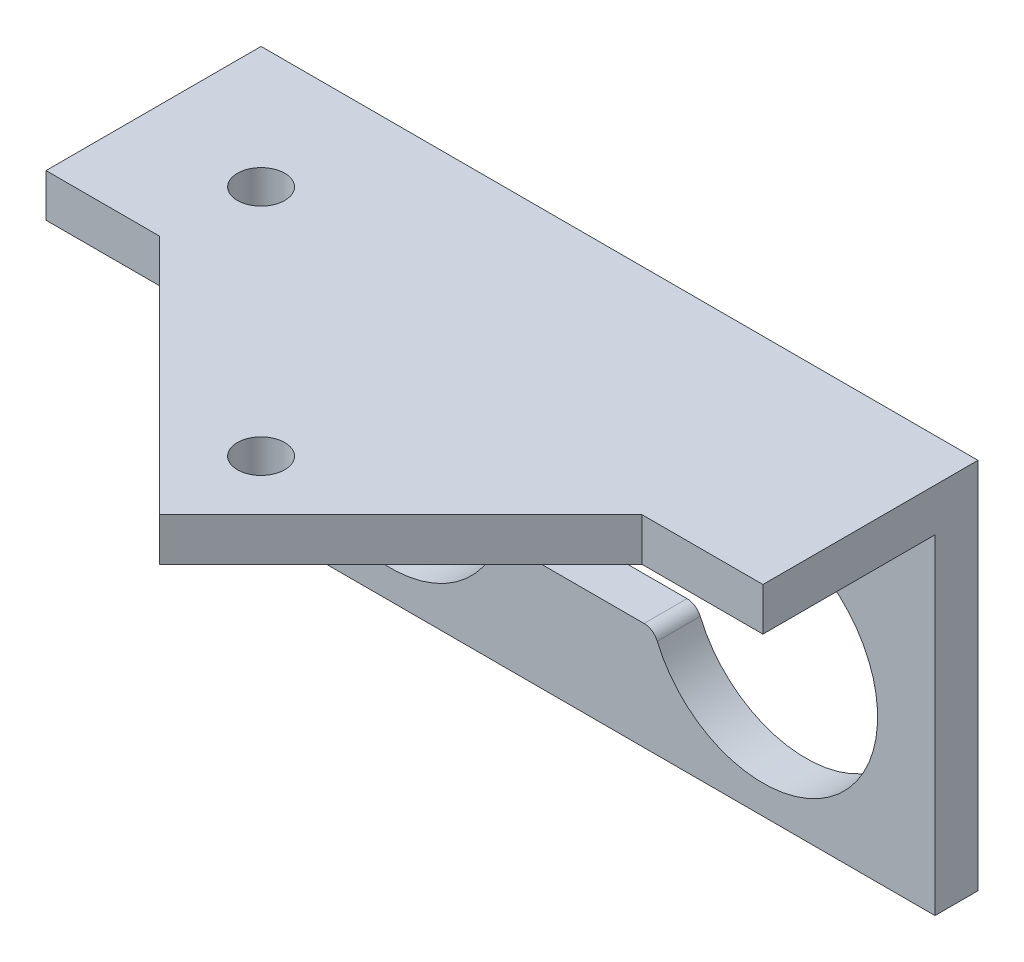
from build123d import *

# Parameters (mm, degrees)
SKETCH_1_W          = 50
SKETCH_1_H          = 20
EXTRUDE_1_DEPTH     = 3
SKETCH_2_W          = 50
SKETCH_2_H          = 15
EXTRUDE_2_DEPTH     = 6
SKETCH_5_W          = 50
SKETCH_5_H          = 12
CUT_EXTRUDE_2_DEPTH = 3
SKETCH_7_R          = 1.65
EXTRUDE_3_DEPTH     = 3
SKETCH_8_R          = 1.65
CUT_EXTRUDE_3_DEPTH = 3


with BuildPart() as part:
    # 草图1 → 凸台-拉伸1 (new body)
    with BuildSketch(Plane.XY):
        Rectangle(SKETCH_1_W, SKETCH_1_H)
        with BuildLine():
            Line((-4.708438024, 2.5), (4.708438024, 2.5))
            ThreePointArc((4.708438024, 2.5), (5.261208823, 2.666666667), (5.629722688, 3.111111111))
            ThreePointArc((5.629722688, 3.111111111), (21, 0), (5.629722688, -3.111111111))
            ThreePointArc((5.629722688, -3.111111111), (5.261208823, -2.666666667), (4.708438024, -2.5))
            Line((4.708438024, -2.5), (-4.708438024, -2.5))
            ThreePointArc((-4.708438024, -2.5), (-5.261208823, -2.666666667), (-5.629722688, -3.111111111))
            ThreePointArc((-5.629722688, -3.111111111), (-21, 0), (-5.629722688, 3.111111111))
            ThreePointArc((-5.629722688, 3.111111111), (-5.261208823, 2.666666667), (-4.708438024, 2.5))
        make_face(mode=Mode.SUBTRACT)
        with BuildLine():
            Line((3.25, 5.5), (-3.25, 5.5))
            ThreePointArc((-3.25, 5.5), (-5, 7.25), (-3.25, 9))
            Line((-3.25, 9), (3.25, 9))
            ThreePointArc((3.25, 9), (5, 7.25), (3.25, 5.5))
        make_face(mode=Mode.SUBTRACT)
    extrude(amount=EXTRUDE_1_DEPTH)

    # 草图2 → 凸台-拉伸2 (add)
    with BuildSketch(Plane(origin=(0, 10, 0), x_dir=(1, 0, 0), z_dir=(0, 1, 0))):
        with Locations((0, -7.5)):
            Rectangle(SKETCH_2_W, SKETCH_2_H)
    extrude(amount=EXTRUDE_2_DEPTH)

    # 草图5 → 切除-拉伸2 (cut)
    with BuildSketch(Plane.XZ.offset(-10)):
        with Locations((0, 9)):
            Rectangle(SKETCH_5_W, SKETCH_5_H)
    extrude(amount=-CUT_EXTRUDE_2_DEPTH, mode=Mode.SUBTRACT)

    # 草图7 → 凸台-拉伸3 (add)
    with BuildSketch(Plane(origin=(0, 16, 0), x_dir=(1, 0, 0), z_dir=(0, 1, 0))):
        Polygon((-0.251262658, -31.819805153), (-17.071067812, -15), (16.568542495, -15), align=None)
        with Locations(Location((-0.251262658, -24.748737342, 0), (0, 0, 180))):
            Circle(SKETCH_7_R, mode=Mode.SUBTRACT)
    extrude(amount=-EXTRUDE_3_DEPTH)

    # 草图8 → 切除-拉伸3 (cut)
    with BuildSketch(Plane(origin=(0, 16, 0), x_dir=(1, 0, 0), z_dir=(0, 1, 0))):
        with Locations(Location((-16.514718626, -8.485281374, 0), (0, 0, 180))):
            Circle(SKETCH_8_R)
    extrude(amount=-CUT_EXTRUDE_3_DEPTH, mode=Mode.SUBTRACT)


solid = part.part
